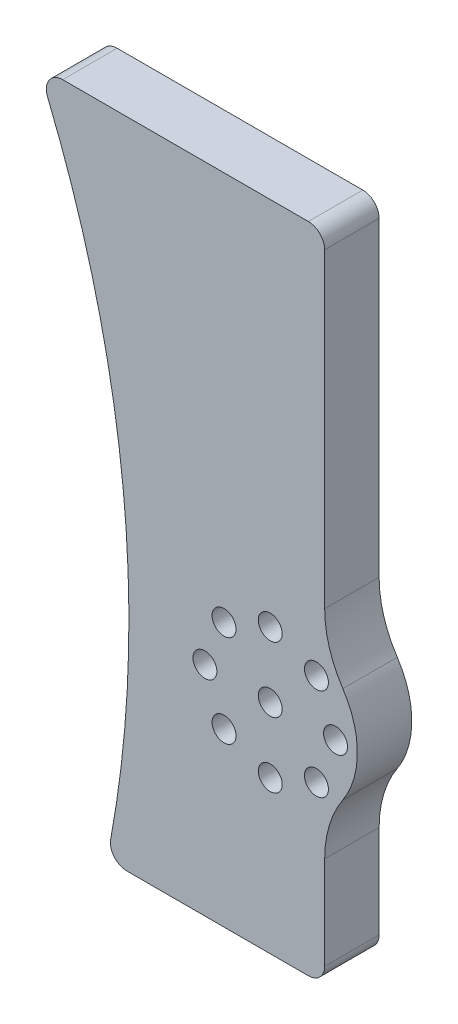
from build123d import *

# Parameters (mm, degrees)
SKETCH_1_R      = 1.1
EXTRUDE_1_DEPTH = 5
EXTRUDE_2_DEPTH = 5
FILLET_1_R      = 1.5


with BuildPart() as part:
    # ｽｹｯﾁ1 → ﾎﾞｽ - 押し出し1 (new body)
    with BuildSketch(Plane.XY):
        with BuildLine():
            Line((-5, 60), (5, 60))
            Line((5, 60), (5, 29.949874371))
            ThreePointArc((5, 29.949874371), (5.425728922, 27.063123025), (6.666666667, 24.422166387))
            ThreePointArc((6.666666667, 24.422166387), (8, 20), (6.666666667, 15.577833613))
            ThreePointArc((6.666666667, 15.577833613), (5.425728922, 12.936876975), (5, 10.050125629))
            Line((5, 10.050125629), (5, 0))
            Line((5, 0), (-5, 0))
            Line((-5, 0), (-5, 10.050125629))
            ThreePointArc((-5, 10.050125629), (-5.425728922, 12.936876975), (-6.666666667, 15.577833613))
            ThreePointArc((-6.666666667, 15.577833613), (-8, 20), (-6.666666667, 24.422166387))
            ThreePointArc((-6.666666667, 24.422166387), (-5.425728922, 27.063123025), (-5, 29.949874371))
            Line((-5, 29.949874371), (-5, 60))
        make_face()
        with Locations((0, 20)):
            Circle(SKETCH_1_R, mode=Mode.SUBTRACT)
        with Locations((0, 14)):
            Circle(SKETCH_1_R, mode=Mode.SUBTRACT)
        with Locations((-4.242640687, 15.757359313)):
            Circle(SKETCH_1_R, mode=Mode.SUBTRACT)
        with Locations((-6, 20)):
            Circle(SKETCH_1_R, mode=Mode.SUBTRACT)
        with Locations((-4.242640687, 24.242640687)):
            Circle(SKETCH_1_R, mode=Mode.SUBTRACT)
        with Locations((0, 26)):
            Circle(SKETCH_1_R, mode=Mode.SUBTRACT)
        with Locations((4.242640687, 24.242640687)):
            Circle(SKETCH_1_R, mode=Mode.SUBTRACT)
        with Locations((6, 20)):
            Circle(SKETCH_1_R, mode=Mode.SUBTRACT)
        with Locations((4.242640687, 15.757359313)):
            Circle(SKETCH_1_R, mode=Mode.SUBTRACT)
    extrude(amount=EXTRUDE_1_DEPTH)

    # ｽｹｯﾁ2 → ﾎﾞｽ - 押し出し2 (add)
    with BuildSketch(Plane(origin=(0, 0, 0), x_dir=(-1, 0, 0), z_dir=(0, 0, -1))):
        with BuildLine():
            Line((5, 10.050125629), (5, 0))
            Line((5, 0), (15, 0))
            ThreePointArc((15, 0), (13.531166576, 30.48861935), (21.328075812, 60))
            Line((21.328075812, 60), (5, 60))
            Line((5, 60), (5, 29.949874371))
            ThreePointArc((5, 29.949874371), (5.425728922, 27.063123025), (6.666666667, 24.422166387))
            ThreePointArc((6.666666667, 24.422166387), (8, 20), (6.666666667, 15.577833613))
            ThreePointArc((6.666666667, 15.577833613), (5.425728922, 12.936876975), (5, 10.050125629))
        make_face()
    extrude(amount=-EXTRUDE_2_DEPTH)

    # ﾌｨﾚｯﾄ1
    fillet_1_edges = [part.edges().sort_by_distance(p)[0] for p in [
        (5, 0, 2.5),
        (5, 60, 2.5),
        (-21.328075812, 60, 2.5),
        (-15, 0, 2.5),
    ]]
    fillet(fillet_1_edges, radius=FILLET_1_R)


solid = part.part
